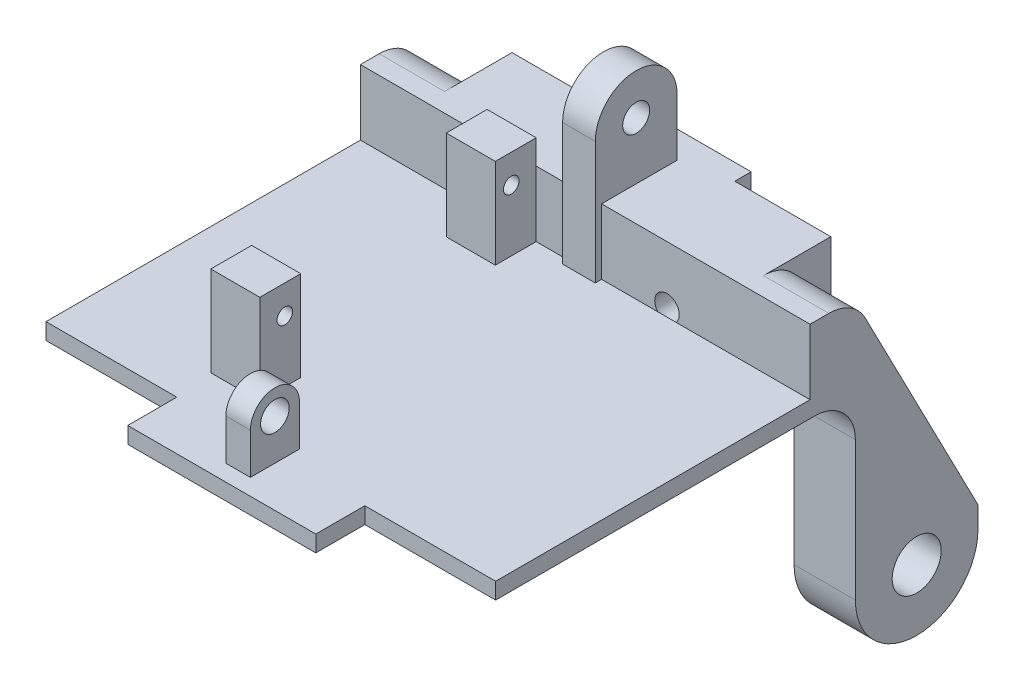
from build123d import *

# Parameters (mm, degrees)
SKETCH_1_W          = 55
SKETCH_1_H          = 39
EXTRUDE_1_DEPTH     = 2
SKETCH_2_W          = 23
SKETCH_2_H          = 6
EXTRUDE_2_DEPTH     = 2
SKETCH_3_W          = 6
SKETCH_3_H          = 5
EXTRUDE_3_DEPTH     = 11
SKETCH_5_R          = 0.95
CUT_EXTRUDE_1_DEPTH = 11
SKETCH_6_W          = 55
SKETCH_6_H          = 0.541458129
EXTRUDE_4_DEPTH     = 8
SKETCH_8_R          = 1.65
EXTRUDE_6_DEPTH     = 2
SKETCH_10_W         = 3
SKETCH_10_H         = 6
EXTRUDE_7_DEPTH     = 8
SKETCH_11_R         = 1.5
CUT_EXTRUDE_3_DEPTH = 13
SKETCH_12_R         = 3
EXTRUDE_8_DEPTH     = 7.5
SKETCH_13_W         = 10
SKETCH_13_H         = 3.7
EXTRUDE_9_DEPTH     = 1
FILLET_3_RADIUS     = 3
FILLET_3_LENGTH     = 3
SKETCH_15_R         = 1.75
CUT_EXTRUDE_5_DEPTH = 23
SKETCH_16_W         = 15.5
SKETCH_16_H         = 4
EXTRUDE_10_DEPTH    = 20
SKETCH_17_R         = 1.5
EXTRUDE_11_DEPTH    = 10
FILLET_4_R          = 10
SKETCH_18_W         = 26.564734734
SKETCH_18_H         = 10.454508508
CUT_EXTRUDE_6_DEPTH = 10
CUT_EXTRUDE_7_DEPTH = 8
CUT_EXTRUDE_8_DEPTH = 8
FILLET_6_R          = 5
SKETCH_21_R         = 1.4
CUT_EXTRUDE_9_DEPTH = 4


with BuildPart() as part:
    # 草图1 → 凸台-拉伸1 (new body)
    with BuildSketch(Plane(origin=(0, 0, 0), x_dir=(1, 0, 0), z_dir=(0, 1, 0))):
        Rectangle(SKETCH_1_W, SKETCH_1_H)
    extrude(amount=EXTRUDE_1_DEPTH)

    # 草图2 → 凸台-拉伸2 (add)
    with BuildSketch(Plane(origin=(0, 2, 0), x_dir=(1, 0, 0), z_dir=(0, 1, 0))):
        with Locations((0, -22.5)):
            Rectangle(SKETCH_2_W, SKETCH_2_H)
    extrude(amount=-EXTRUDE_2_DEPTH)

    # 草图3 → 凸台-拉伸3 (add)
    with BuildSketch(Plane(origin=(0, 2, 0), x_dir=(1, 0, 0), z_dir=(0, 1, 0))):
        with Locations((-9, -12.341458129)):
            Rectangle(SKETCH_3_W, SKETCH_3_H)
        with Locations((-9, 16.458541871)):
            Rectangle(SKETCH_3_W, SKETCH_3_H)
    extrude(amount=EXTRUDE_3_DEPTH)

    # 草图5 → 切除-拉伸1 (cut)
    with BuildSketch(Plane.ZY.offset(12)):
        with Locations((-15.908541871, 9.5)):
            Circle(SKETCH_5_R)
        with Locations((11.791458129, 9.5)):
            Circle(SKETCH_5_R)
    extrude(amount=-CUT_EXTRUDE_1_DEPTH, mode=Mode.SUBTRACT)

    # 草图6 → 凸台-拉伸4 (add)
    with BuildSketch(Plane(origin=(0, 2, 0), x_dir=(1, 0, 0), z_dir=(0, 1, 0))):
        with Locations((0, 19.229270936)):
            Rectangle(SKETCH_6_W, SKETCH_6_H)
    extrude(amount=EXTRUDE_4_DEPTH)

    # 草图8 → 凸台-拉伸6 (add, symmetric)
    with BuildSketch(Plane(origin=(0, 0, 0), x_dir=(0, 0, -1), z_dir=(1, 0, 0))):
        with BuildLine():
            Line((28.189872998, 17), (28.189872998, 0))
            Line((28.189872998, 0), (18.189872998, 0))
            Line((18.189872998, 0), (18.189872998, 17))
            ThreePointArc((18.189872998, 17), (23.189872998, 22), (28.189872998, 17))
        make_face()
        with Locations((23.189872998, 17)):
            Circle(SKETCH_8_R, mode=Mode.SUBTRACT)
    extrude(amount=EXTRUDE_6_DEPTH, both=True)

    # 草图10 → 凸台-拉伸7 (add)
    with BuildSketch(Plane(origin=(0, 2, 0), x_dir=(1, 0, 0), z_dir=(0, 1, 0))):
        with Locations((0, -20.5)):
            Rectangle(SKETCH_10_W, SKETCH_10_H)
    extrude(amount=EXTRUDE_7_DEPTH)

    # 草图11 → 切除-拉伸3 (cut)
    with BuildSketch(Plane.XY.offset(-18.958541871)):
        with Locations((-10, 3)):
            Circle(SKETCH_11_R)
    cut_extrude_3 = extrude(amount=-CUT_EXTRUDE_3_DEPTH, mode=Mode.SUBTRACT)

    # 草图12 → 凸台-拉伸8 (add)
    with BuildSketch(Plane.ZY.offset(27.5)):
        with BuildLine():
            Line((-39.5, -22), (-39.5, 10))
            Line((-39.5, 10), (-19.5, 10))
            Line((-19.5, 10), (-19.5, 0))
            Line((-19.5, 0), (-24.5, 0))
            Line((-24.5, 0), (-24.5, -22))
            ThreePointArc((-24.5, -22), (-32, -29.5), (-39.5, -22))
        make_face()
        with Locations((-32, -22)):
            Circle(SKETCH_12_R, mode=Mode.SUBTRACT)
    extrude_8 = extrude(amount=-EXTRUDE_8_DEPTH)

    # 草图13 → 凸台-拉伸9 (add)
    with BuildSketch(Plane.XZ):
        with Locations((0, 19.15)):
            Rectangle(SKETCH_13_W, SKETCH_13_H)
    extrude(amount=EXTRUDE_9_DEPTH)

    # 镜向1: 切除-拉伸3, 凸台-拉伸8 across plane
    add(cut_extrude_3.mirror(Plane(origin=(0, 0, 0), x_dir=(0, 0, 1), z_dir=(1, 0, 0))), mode=Mode.SUBTRACT)
    add(extrude_8.mirror(Plane(origin=(0, 0, 0), x_dir=(0, 0, 1), z_dir=(1, 0, 0))))

    # 圆角3: full round fillet: the end face becomes a half cylinder, R = half its width
    fillet_3_face = Plane((0, 10, 20.5), x_dir=(1, 0, 0), z_dir=(0, 1, 0))  # on the end face: x along it, z out of the body
    fillet_3_slab = fillet_3_face.offset(-FILLET_3_RADIUS / 2) * Box(FILLET_3_LENGTH, 2 * FILLET_3_RADIUS, FILLET_3_RADIUS, mode=Mode.PRIVATE)  # the body's end, R deep
    fillet_3_round = Plane((0, 7, 20.5), x_dir=(0, 1, 0), z_dir=(1, 0, 0)) * Cylinder(FILLET_3_RADIUS, FILLET_3_LENGTH, mode=Mode.PRIVATE)  # its axis R under the face
    add(fillet_3_slab - fillet_3_round, mode=Mode.SUBTRACT)

    # 草图15 → 切除-拉伸5 (cut)
    with BuildSketch(Plane.ZY.offset(1.5)):
        with Locations((20.5, 7)):
            Circle(SKETCH_15_R)
    extrude(amount=-CUT_EXTRUDE_5_DEPTH, mode=Mode.SUBTRACT)

    # 草图16 → 凸台-拉伸10 (add)
    with BuildSketch(Plane(origin=(0, 0, -19.5), x_dir=(-1, 0, 0), z_dir=(0, 0, -1))):
        with Locations((0, 8)):
            Rectangle(SKETCH_16_W, SKETCH_16_H)
    extrude(amount=EXTRUDE_10_DEPTH)

    # 草图17 → 凸台-拉伸11 (add)
    # profile 1 of 2: a face of its own
    with BuildSketch(Plane(origin=(0, 0, -19.5), x_dir=(-1, 0, 0), z_dir=(0, 0, -1))):
        Polygon((-20, 0), (-2, 0), (-2, 6), (-7.75, 6), (-7.75, 10), (-20, 10), align=None)
        with Locations(Location((-10, 3, 0), (0, 0, 221.810314896))):
            Circle(SKETCH_17_R, mode=Mode.SUBTRACT)
    # profile 2 of 2: a face of its own
    with BuildSketch(Plane(origin=(0, 0, -19.5), x_dir=(-1, 0, 0), z_dir=(0, 0, -1))):
        Polygon((7.75, 6), (2, 6), (2, 0), (20, 0), (20, 10), (7.75, 10), align=None)
        with Locations(Location((10, 3, 0), (0, 0, 180))):
            Circle(SKETCH_17_R, mode=Mode.SUBTRACT)
    extrude(amount=EXTRUDE_11_DEPTH)

    # 圆角4
    fillet_4_edges = [part.edges().sort_by_distance(p)[0] for p in [
        (23.75, 10, -39.5),
        (-23.75, 10, -39.5),
    ]]
    fillet(fillet_4_edges, radius=FILLET_4_R)

    # 草图18 → 切除-拉伸6 (cut)
    with BuildSketch(Plane(origin=(0, 10, 0), x_dir=(1, 0, 0), z_dir=(0, 1, 0))):
        with Locations((-0.840887807, 36.727254254)):
            Rectangle(SKETCH_18_W, SKETCH_18_H)
    extrude(amount=-CUT_EXTRUDE_6_DEPTH, mode=Mode.SUBTRACT)

    # 草图19 → 切除-拉伸7 (cut)
    with BuildSketch(Plane(origin=(27.5, 0, 0), x_dir=(0, 0, -1), z_dir=(1, 0, 0))):
        Polygon((24.3, 10), (39.5, -19.395601839), (39.5, 10), align=None)
    extrude(amount=-CUT_EXTRUDE_7_DEPTH, mode=Mode.SUBTRACT)

    # 草图20 → 切除-拉伸8 (cut)
    with BuildSketch(Plane.ZY.offset(27.5)):
        Polygon((-24.3, 10), (-39.5, 10), (-39.5, -19.395601839), align=None)
    extrude(amount=-CUT_EXTRUDE_8_DEPTH, mode=Mode.SUBTRACT)

    # 圆角6
    fillet_6_edges = [part.edges().sort_by_distance(p)[0] for p in [
        (-23.75, 0, -24.5),
        (23.75, 0, -24.5),
        (23.5, 10, -24.3),
        (-23.5, 10, -24.3),
    ]]
    fillet(fillet_6_edges, radius=FILLET_6_R)

    # 草图21 → 切除-拉伸9 (cut)
    with BuildSketch(Plane.XZ.offset(1)):
        with Locations(Location((0, 19.15, 0), (0, 0, 270))):
            Circle(SKETCH_21_R)
    extrude(amount=-CUT_EXTRUDE_9_DEPTH, mode=Mode.SUBTRACT)


solid = part.part
